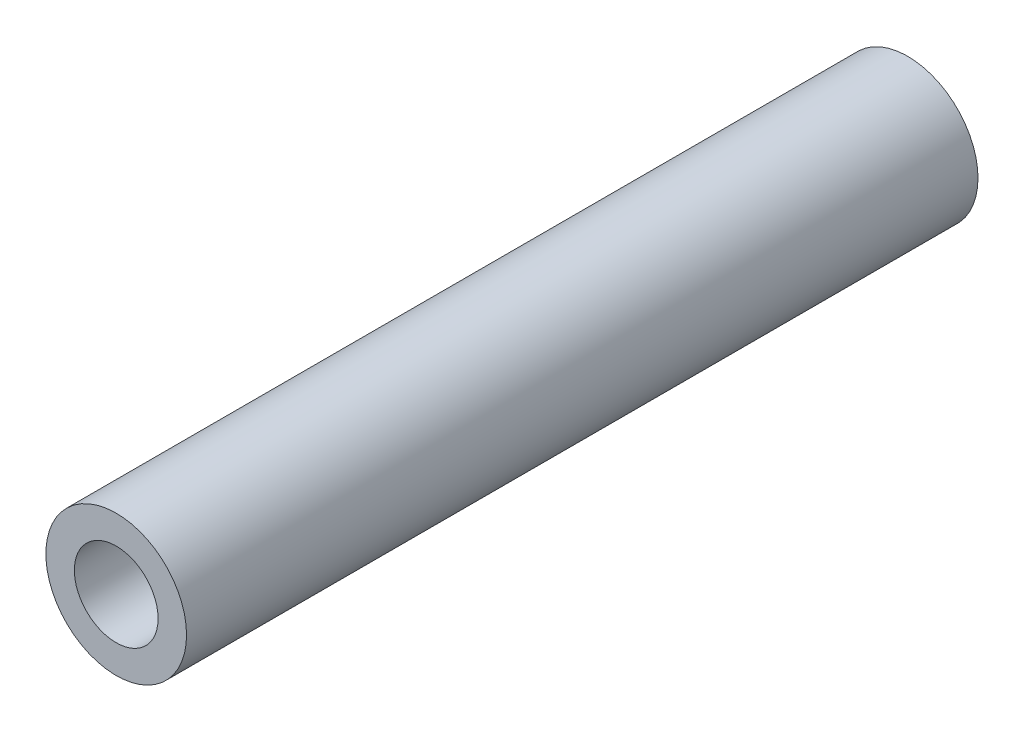
from build123d import *

# Parameters (mm, degrees)
SKETCH1_R           = 10.665
SKETCH1_R_2         = 6.35
BOSS_EXTRUDE1_DEPTH = 120


with BuildPart() as part:
    # Sketch1 → Boss-Extrude1 (new body)
    with BuildSketch(Plane.XY):
        Circle(SKETCH1_R)
        Circle(SKETCH1_R_2, mode=Mode.SUBTRACT)
    extrude(amount=BOSS_EXTRUDE1_DEPTH)


solid = part.part
